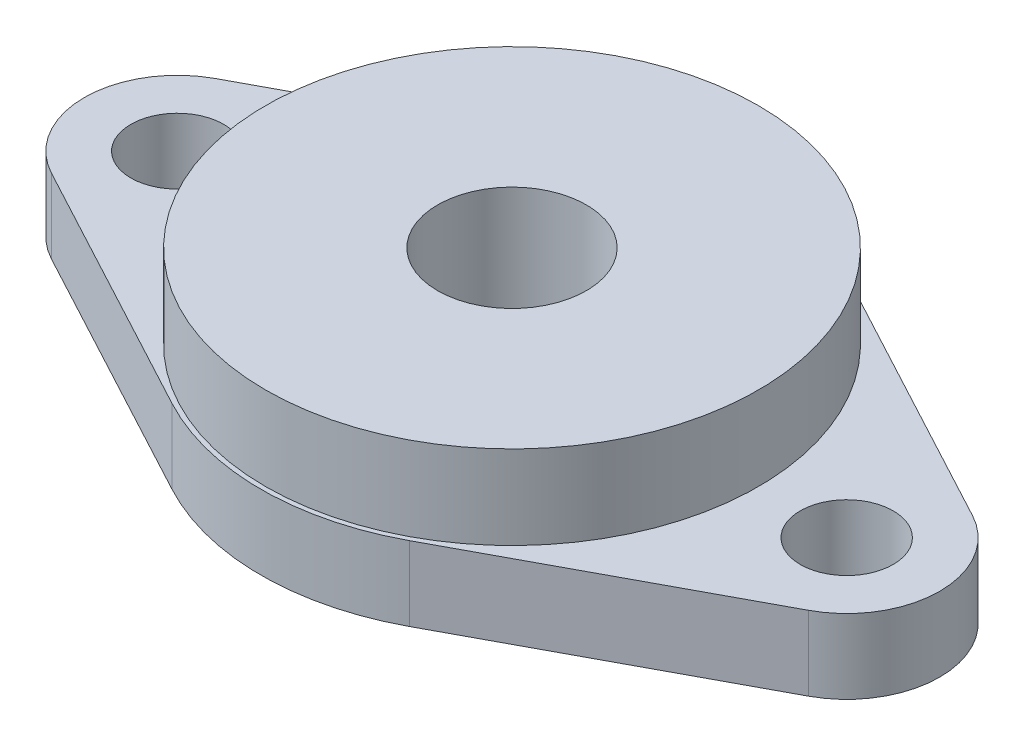
from build123d import *

# Parameters (mm, degrees)
SKETCH_1_R      = 4
SKETCH_1_R_2    = 2.5
EXTRUDE_1_DEPTH = 4
SKETCH_2_R      = 13.25
SKETCH_2_R_2    = 4
EXTRUDE_2_DEPTH = 4.5


with BuildPart() as part:
    # 草图1 → 凸台-拉伸1 (new body)
    with BuildSketch(Plane(origin=(0, 0, 0), x_dir=(1, 0, 0), z_dir=(0, 1, 0))):
        with BuildLine():
            Line((20.361111111, -4.407397681), (6.375, -11.899973739))
            ThreePointArc((6.375, -11.899973739), (0, -13.5), (-6.375, -11.899973739))
            Line((-6.375, -11.899973739), (-20.361111111, -4.407397681))
            ThreePointArc((-20.361111111, -4.407397681), (-23, 0), (-20.361111111, 4.407397681))
            Line((-20.361111111, 4.407397681), (-6.375, 11.899973739))
            ThreePointArc((-6.375, 11.899973739), (0, 13.5), (6.375, 11.899973739))
            Line((6.375, 11.899973739), (20.361111111, 4.407397681))
            ThreePointArc((20.361111111, 4.407397681), (23, 0), (20.361111111, -4.407397681))
        make_face()
        with Locations(Location((0, 0, 0), (0, 0, 270))):
            Circle(SKETCH_1_R, mode=Mode.SUBTRACT)
        with Locations(Location((18, 0, 0), (0, 0, 270))):
            Circle(SKETCH_1_R_2, mode=Mode.SUBTRACT)
        with Locations(Location((-18, 0, 0), (0, 0, 270))):
            Circle(SKETCH_1_R_2, mode=Mode.SUBTRACT)
    extrude(amount=EXTRUDE_1_DEPTH)

    # 草图2 → 凸台-拉伸2 (add)
    with BuildSketch(Plane(origin=(0, 4, 0), x_dir=(1, 0, 0), z_dir=(0, 1, 0))):
        with Locations(Location((0, 0, 0), (0, 0, 270))):
            Circle(SKETCH_2_R)
        with Locations(Location((0, 0, 0), (0, 0, 270))):
            Circle(SKETCH_2_R_2, mode=Mode.SUBTRACT)
    extrude(amount=EXTRUDE_2_DEPTH)


solid = part.part
